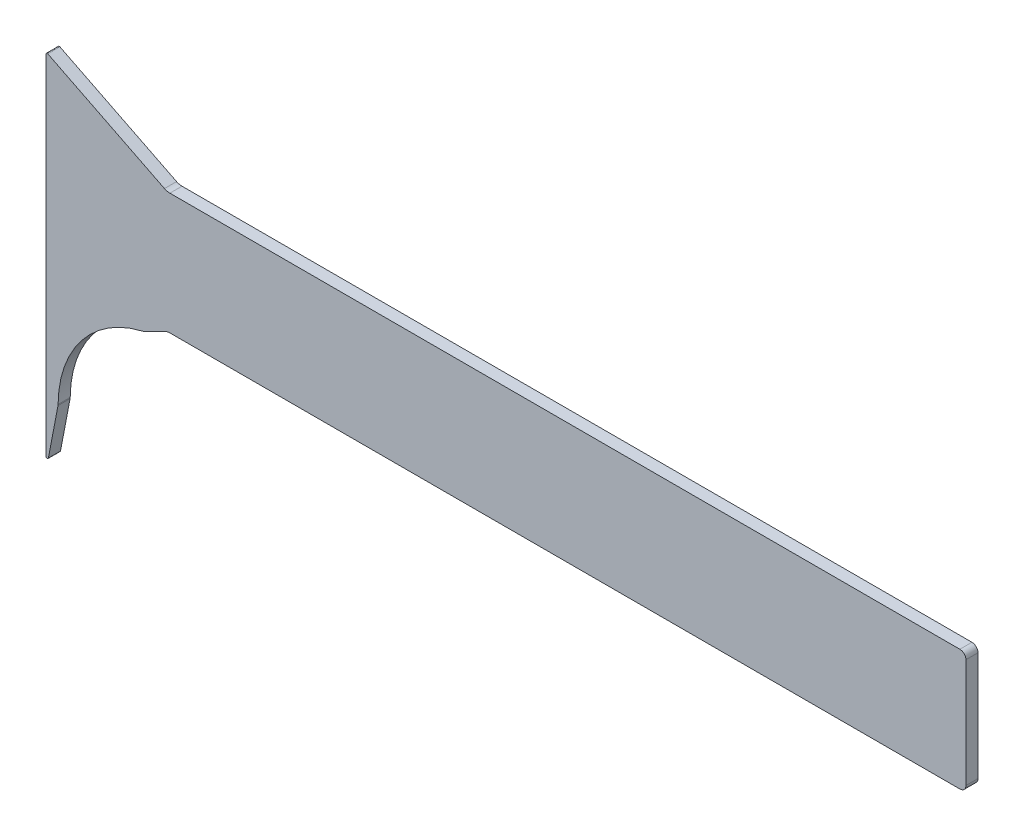
from build123d import *

# Parameters (mm, degrees)
BOSS_EXTRUDE1_DEPTH = 10


with BuildPart() as part:
    # Sketch1 → Boss-Extrude1 (new body)
    with BuildSketch(Plane.XY):
        with BuildLine():
            Line((1.447213595, 99.276393202), (97.88854382, 51.05572809))
            ThreePointArc((97.88854382, 51.05572809), (100.06315057, 50.267510105), (102.360679775, 50))
            Line((102.360679775, 50), (755, 50))
            ThreePointArc((755, 50), (758.535533906, 48.535533906), (760, 45))
            Line((760, 45), (760, -45.000000001))
            ThreePointArc((760, -45.000000001), (758.535533906, -48.535533907), (755, -50.000000001))
            Line((755, -50.000000001), (102.360679777, -50.000000001))
            ThreePointArc((102.360679777, -50.000000001), (100.06315057, -50.267510107), (97.888543818, -51.055728093))
            Line((97.888543818, -51.055728093), (80.530859307, -59.734570358))
            ThreePointArc((80.530859307, -59.734570358), (79.995557001, -59.964284692), (79.437170731, -60.130182272))
            ThreePointArc((79.437170731, -60.130182272), (29.605594549, -91.672663918), (10.00115127, -147.294421683))
            ThreePointArc((10.00115127, -147.294421683), (9.977672992, -147.753763522), (9.912084694, -148.209004479))
            Line((9.912084694, -148.209004479), (1.982173893, -189.643070819))
            ThreePointArc((1.982173893, -189.643070819), (0.90559103, -190.450629734), (0, -189.455096236))
            Line((0, -189.455096236), (0, 98.381966011))
            ThreePointArc((0, 98.381966011), (0.474268888, 99.23261682), (1.447213595, 99.276393202))
        make_face()
    extrude(amount=BOSS_EXTRUDE1_DEPTH)


solid = part.part
